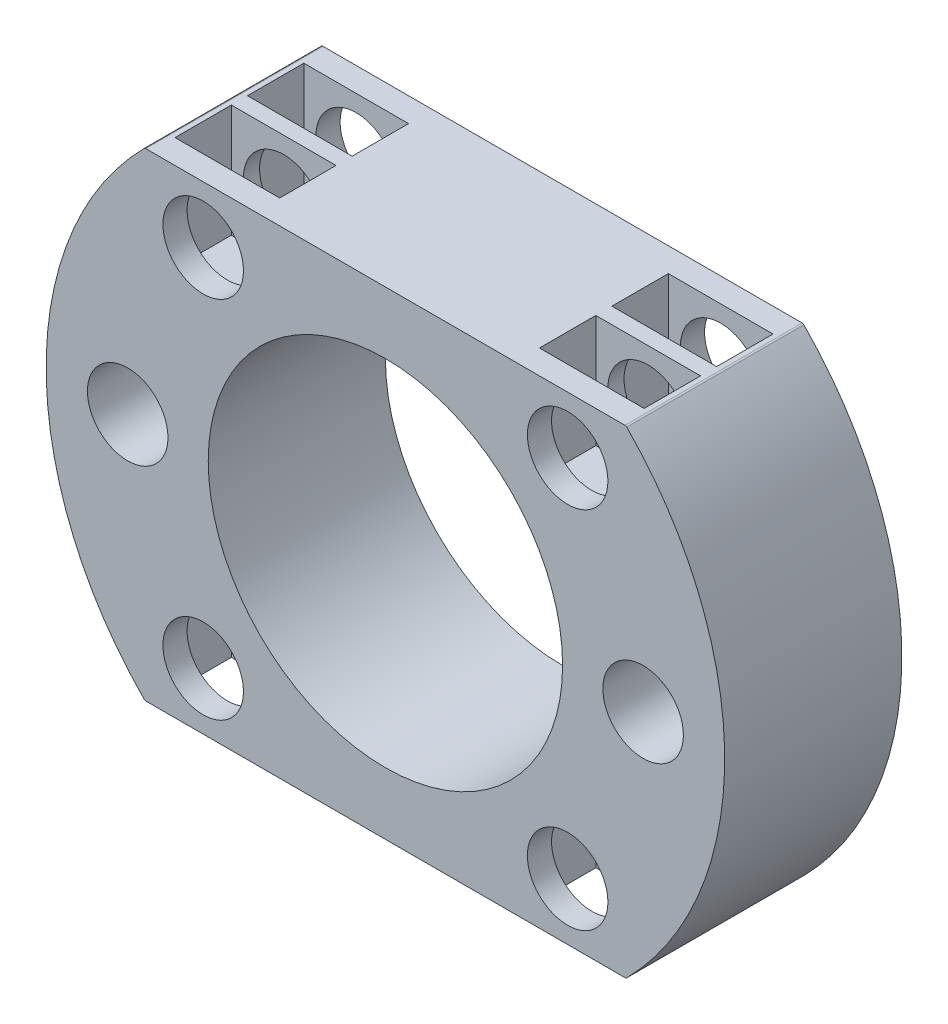
from build123d import *

# Parameters (mm, degrees)
ESQUISSE1_R             = 2.5
BOSS_EXTRU_1_DEPTH      = 11
ESQUISSE2_W             = 6.5
ESQUISSE2_H             = 3.5
ENL_V_MAT_EXTRU_1_DEPTH = 7
ESQUISSE3_W             = 6.5
ESQUISSE3_H             = 3.5
ENL_V_MAT_EXTRU_2_DEPTH = 7
ESQUISSE4_R             = 11
ENL_V_MAT_EXTRU_3_DEPTH = 21


with BuildPart() as part:
    # Esquisse1 → Boss.-Extru.1 (new body)
    with BuildSketch(Plane.XY):
        with BuildLine():
            Line((14.875216904, 14.85), (-14.875216904, 14.85))
            ThreePointArc((-14.875216904, 14.85), (-14.933029672, 14.838411285), (-14.981909432, 14.805435784))
            ThreePointArc((-14.981909432, 14.805435784), (-21.063203436, 0), (-14.981909432, -14.805435784))
            ThreePointArc((-14.981909432, -14.805435784), (-14.933029672, -14.838411285), (-14.875216904, -14.85))
            Line((-14.875216904, -14.85), (14.875216904, -14.85))
            ThreePointArc((14.875216904, -14.85), (14.933029672, -14.838411285), (14.981909432, -14.805435784))
            ThreePointArc((14.981909432, -14.805435784), (21.063203436, 0), (14.981909432, 14.805435784))
            ThreePointArc((14.981909432, 14.805435784), (14.933029672, 14.838411285), (14.875216904, 14.85))
        make_face()
        with Locations((-16, 0)):
            Circle(ESQUISSE1_R, mode=Mode.SUBTRACT)
        with Locations((-11.313708499, 11.313708499)):
            Circle(ESQUISSE1_R, mode=Mode.SUBTRACT)
        with Locations((-11.313708499, -11.313708499)):
            Circle(ESQUISSE1_R, mode=Mode.SUBTRACT)
        with Locations((11.313708499, -11.313708499)):
            Circle(ESQUISSE1_R, mode=Mode.SUBTRACT)
        with Locations((16, 0)):
            Circle(ESQUISSE1_R, mode=Mode.SUBTRACT)
        with Locations((11.313708499, 11.313708499)):
            Circle(ESQUISSE1_R, mode=Mode.SUBTRACT)
    extrude(amount=BOSS_EXTRU_1_DEPTH)

    # Esquisse2 → Enlèv. mat.-Extru.1 (cut)
    with BuildSketch(Plane(origin=(0, 14.85, 0), x_dir=(1, 0, 0), z_dir=(0, 1, 0))):
        with Locations((11.313708499, -3.25)):
            Rectangle(ESQUISSE2_W, ESQUISSE2_H)
        with Locations((-11.313708499, -3.25)):
            Rectangle(ESQUISSE2_W, ESQUISSE2_H)
        with Locations((11.313708499, -7.75)):
            Rectangle(ESQUISSE2_W, ESQUISSE2_H)
        with Locations((-11.313708499, -7.75)):
            Rectangle(ESQUISSE2_W, ESQUISSE2_H)
    extrude(amount=-ENL_V_MAT_EXTRU_1_DEPTH, mode=Mode.SUBTRACT)

    # Esquisse3 → Enlèv. mat.-Extru.2 (cut)
    with BuildSketch(Plane.XZ.offset(14.85)):
        with Locations((-11.313708499, 3.25)):
            Rectangle(ESQUISSE3_W, ESQUISSE3_H)
        with Locations((-11.313708499, 7.75)):
            Rectangle(ESQUISSE3_W, ESQUISSE3_H)
        with Locations((11.313708499, 3.25)):
            Rectangle(ESQUISSE3_W, ESQUISSE3_H)
        with Locations((11.313708499, 7.75)):
            Rectangle(ESQUISSE3_W, ESQUISSE3_H)
    extrude(amount=-ENL_V_MAT_EXTRU_2_DEPTH, mode=Mode.SUBTRACT)

    # Esquisse4 → Enlèv. mat.-Extru.3 (cut)
    with BuildSketch(Plane.XY.offset(11)):
        Circle(ESQUISSE4_R)
    extrude(amount=-ENL_V_MAT_EXTRU_3_DEPTH, mode=Mode.SUBTRACT)


solid = part.part
